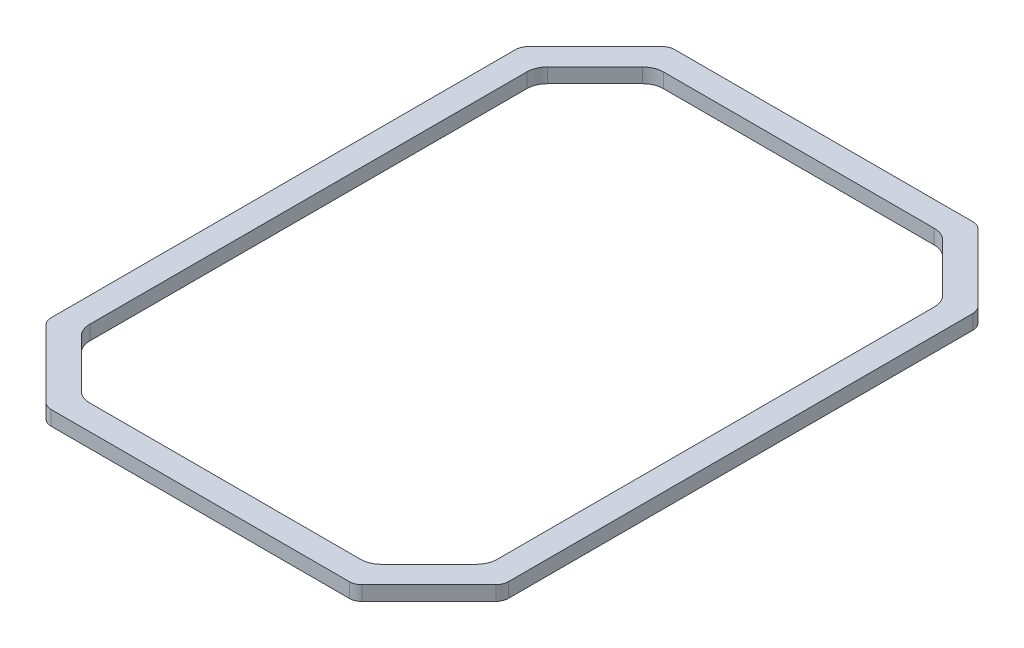
from build123d import *

# Parameters (mm, degrees)
BOSS_EXTRUDE1_DEPTH = 1.75


with BuildPart() as part:
    # Sketch1 → Boss-Extrude1 (new body)
    with BuildSketch(Plane(origin=(-905.783657891, 0, -1752.480725949), x_dir=(1, 0, 0), z_dir=(0, 1, 0))):
        with BuildLine():
            Line((5.86809467, -1.289791394), (-2.192922636, -9.3508087))
            ThreePointArc((-2.192922636, -9.3508087), (-2.518081763, -9.837443723), (-2.632262464, -10.411468871))
            Line((-2.632262464, -10.411468871), (-2.632262464, -66.28943426))
            ThreePointArc((-2.632262464, -66.28943426), (-2.518081763, -66.863459408), (-2.192922636, -67.350094431))
            Line((-2.192922636, -67.350094431), (5.86809467, -75.411111737))
            ThreePointArc((5.86809467, -75.411111737), (6.354729693, -75.736270864), (6.928754842, -75.850451566))
            Line((6.928754842, -75.850451566), (42.80672023, -75.850451566))
            ThreePointArc((42.80672023, -75.850451566), (43.380745379, -75.736270864), (43.867380402, -75.411111737))
            Line((43.867380402, -75.411111737), (51.928397708, -67.350094431))
            ThreePointArc((51.928397708, -67.350094431), (52.253556835, -66.863459408), (52.367737536, -66.28943426))
            Line((52.367737536, -66.28943426), (52.367737536, -10.411468871))
            ThreePointArc((52.367737536, -10.411468871), (52.253556835, -9.837443723), (51.928397708, -9.3508087))
            Line((51.928397708, -9.3508087), (43.867380402, -1.289791394))
            ThreePointArc((43.867380402, -1.289791394), (43.380745379, -0.964632267), (42.80672023, -0.850451566))
            Line((42.80672023, -0.850451566), (6.928754842, -0.850451566))
            ThreePointArc((6.928754842, -0.850451566), (6.354729693, -0.964632267), (5.86809467, -1.289791394))
        make_face()
        with BuildLine():
            Line((6.817842138, -4.582684613), (1.099970583, -10.300556168))
            ThreePointArc((1.099970583, -10.300556168), (0.558038705, -11.11161454), (0.367737536, -12.068323121))
            Line((0.367737536, -12.068323121), (0.367737536, -64.63258001))
            ThreePointArc((0.367737536, -64.63258001), (0.558038705, -65.589288591), (1.099970583, -66.400346963))
            Line((1.099970583, -66.400346963), (6.817842138, -72.118218519))
            ThreePointArc((6.817842138, -72.118218519), (7.62890051, -72.660150397), (8.585609091, -72.850451566))
            Line((8.585609091, -72.850451566), (41.149865981, -72.850451566))
            ThreePointArc((41.149865981, -72.850451566), (42.106574562, -72.660150397), (42.917632934, -72.118218519))
            Line((42.917632934, -72.118218519), (48.635504489, -66.400346963))
            ThreePointArc((48.635504489, -66.400346963), (49.177436367, -65.589288591), (49.367737536, -64.63258001))
            Line((49.367737536, -64.63258001), (49.367737536, -12.068323121))
            ThreePointArc((49.367737536, -12.068323121), (49.177436367, -11.11161454), (48.635504489, -10.300556168))
            Line((48.635504489, -10.300556168), (42.917632934, -4.582684613))
            ThreePointArc((42.917632934, -4.582684613), (42.106574562, -4.040752734), (41.149865981, -3.850451566))
            Line((41.149865981, -3.850451566), (8.585609091, -3.850451566))
            ThreePointArc((8.585609091, -3.850451566), (7.62890051, -4.040752734), (6.817842138, -4.582684613))
        make_face(mode=Mode.SUBTRACT)
    extrude(amount=BOSS_EXTRUDE1_DEPTH)


solid = part.part
